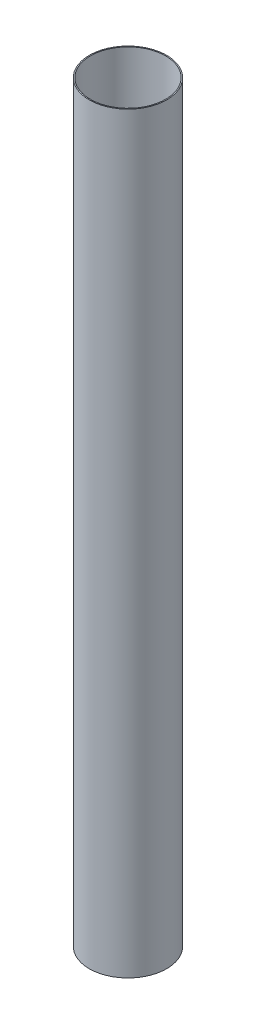
from build123d import *

# Parameters (mm, degrees)
SKETCH1_R           = 78.359
SKETCH1_R_2         = 76.2
BOSS_EXTRUDE1_DEPTH = 1524


with BuildPart() as part:
    # Sketch1 → Boss-Extrude1 (new body)
    with BuildSketch(Plane(origin=(0, 0, 0), x_dir=(1, 0, 0), z_dir=(0, 1, 0))):
        with Locations(Location((0, 0, 0), (0, 0, 270))):
            Circle(SKETCH1_R)
        with Locations(Location((0, 0, 0), (0, 0, 270))):
            Circle(SKETCH1_R_2, mode=Mode.SUBTRACT)
    extrude(amount=BOSS_EXTRUDE1_DEPTH)


solid = part.part
